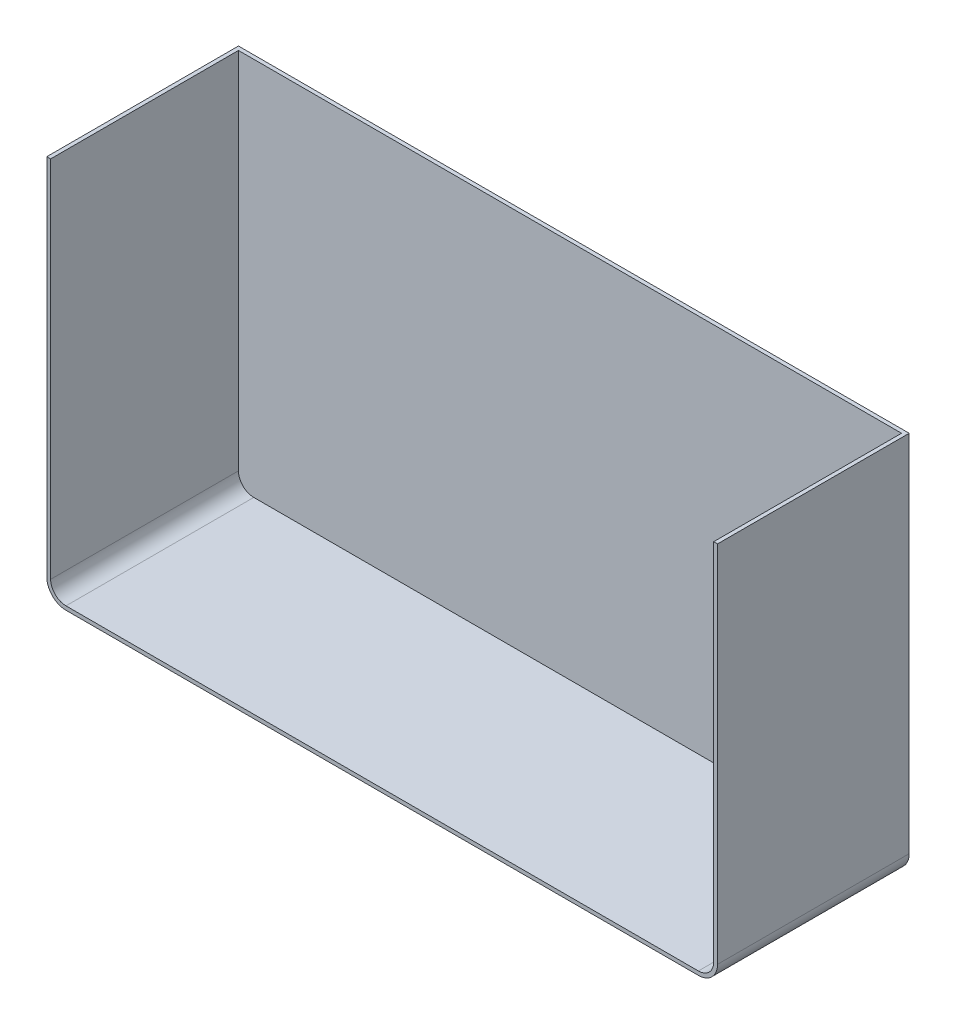
from build123d import *

# Parameters (mm, degrees)
SKETCH_1_W      = 350
SKETCH_1_H      = 200
EXTRUDE_1_DEPTH = 100
FILLET_1_R      = 10
SHELL_1_T       = -2


with BuildPart() as part:
    # 草图1 → 凸台-拉伸1 (new body)
    with BuildSketch(Plane.XY):
        Rectangle(SKETCH_1_W, SKETCH_1_H)
    extrude(amount=EXTRUDE_1_DEPTH)

    # 圆角1
    fillet_1_edges = [part.edges().sort_by_distance(p)[0] for p in [
        (175, -100, 50),
        (-175, -100, 50),
    ]]
    fillet(fillet_1_edges, radius=FILLET_1_R)

    # 抽壳1
    shell_1_openings = [part.faces().sort_by_distance(p)[0] for p in [
        (0, 0.059982012, 100),
        (0, 100, 50),
    ]]
    offset(amount=SHELL_1_T, openings=shell_1_openings, kind=Kind.INTERSECTION)


solid = part.part
